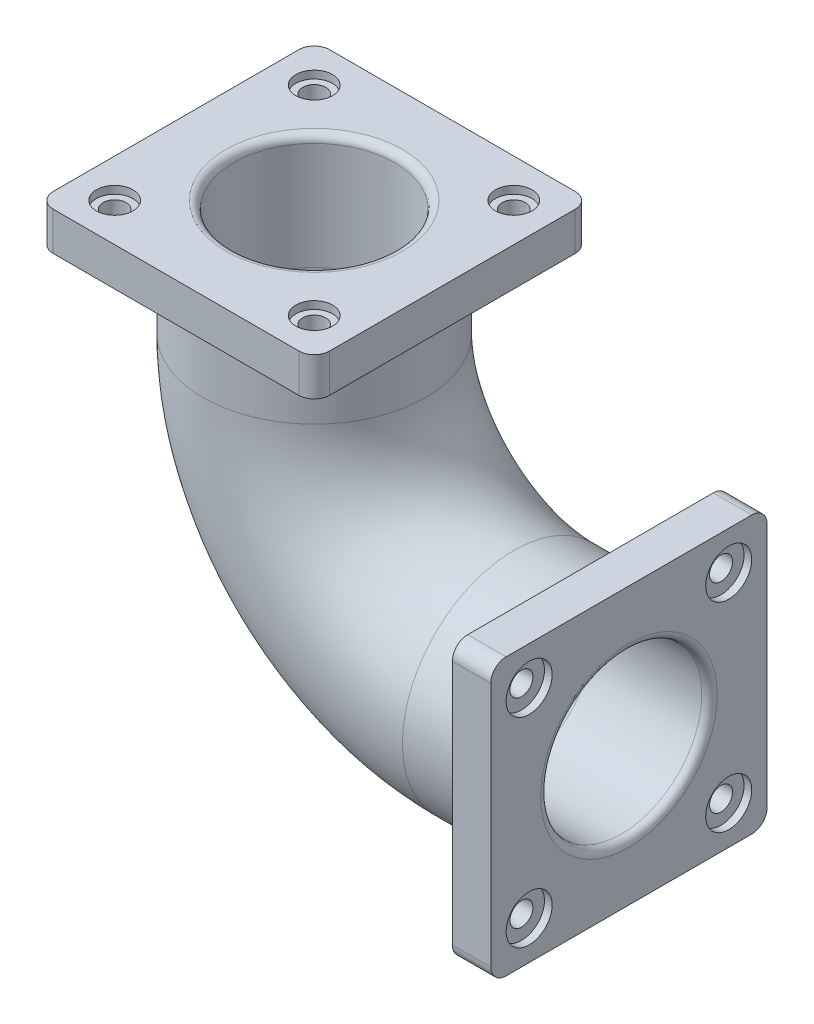
from build123d import *

# Parameters (mm, degrees)
SKETCH1_W           = 360
SKETCH1_H           = 360
SKETCH1_R           = 15
BOSS_EXTRUDE1_DEPTH = 50
FILLET1_R           = 20
SKETCH2_R           = 105
CUT_EXTRUDE1_DEPTH  = 50
SKETCH3_R           = 23.859856378
CUT_EXTRUDE2_DEPTH  = 10
SKETCH5_R           = 145
SKETCH5_R_2         = 105
SKETCH9_W           = 360
SKETCH9_H           = 360
BOSS_EXTRUDE2_DEPTH = 50
FILLET2_R           = 20
SKETCH10_R          = 105
SKETCH10_R_2        = 15
CUT_EXTRUDE3_DEPTH  = 50
SKETCH11_R          = 30
CUT_EXTRUDE4_DEPTH  = 10
FILLET3_R           = 10


with BuildPart() as part:
    # Sketch1 → Boss-Extrude1 (new body)
    with BuildSketch(Plane(origin=(0, 0, 0), x_dir=(1, 0, 0), z_dir=(0, 1, 0))):
        Rectangle(SKETCH1_W, SKETCH1_H)
        with Locations(Location((-130, 130, 0), (0, 0, 270))):
            Circle(SKETCH1_R, mode=Mode.SUBTRACT)
        with Locations(Location((130, 130, 0), (0, 0, 270))):
            Circle(SKETCH1_R, mode=Mode.SUBTRACT)
        with Locations(Location((130, -130, 0), (0, 0, 270))):
            Circle(SKETCH1_R, mode=Mode.SUBTRACT)
        with Locations(Location((-130, -130, 0), (0, 0, 270))):
            Circle(SKETCH1_R, mode=Mode.SUBTRACT)
    extrude(amount=BOSS_EXTRUDE1_DEPTH)

    # Fillet1
    fillet1_edges = [part.edges().sort_by_distance(p)[0] for p in [
        (-180, 25, -180),
        (180, 25, -180),
        (180, 25, 180),
        (-180, 25, 180),
    ]]
    fillet(fillet1_edges, radius=FILLET1_R)

    # Sketch2 → Cut-Extrude1 (cut)
    with BuildSketch(Plane(origin=(0, 50, 0), x_dir=(1, 0, 0), z_dir=(0, 1, 0))):
        with Locations(Location((0, 0, 0), (0, 0, 270))):
            Circle(SKETCH2_R)
    extrude(amount=-CUT_EXTRUDE1_DEPTH, mode=Mode.SUBTRACT)

    # Sketch3 → Cut-Extrude2 (cut)
    with BuildSketch(Plane(origin=(0, 50, 0), x_dir=(1, 0, 0), z_dir=(0, 1, 0))):
        with Locations(Location((-130, 130, 0), (0, 0, 270))):
            Circle(SKETCH3_R)
        with Locations(Location((130, 130, 0), (0, 0, 270))):
            Circle(SKETCH3_R)
        with Locations(Location((130, -130, 0), (0, 0, 270))):
            Circle(SKETCH3_R)
        with Locations(Location((-130, -130, 0), (0, 0, 270))):
            Circle(SKETCH3_R)
    extrude(amount=-CUT_EXTRUDE2_DEPTH, mode=Mode.SUBTRACT)

    # Sweep-Thin1: sweep along a path in Sketch4
    with BuildLine(Plane.XY) as sweep_thin1_path:
        Line((0, 50), (0, -100))
        ThreePointArc((0, -100), (76.152236891, -283.847763109), (260, -360))
        Line((260, -360), (410, -360))
    # Sketch5 → Sweep-Thin1 (sweep)
    with BuildSketch(Plane(origin=(0, 0, 0), x_dir=(1, 0, 0), z_dir=(0, 1, 0))):
        Circle(SKETCH5_R)
        Circle(SKETCH5_R_2, mode=Mode.SUBTRACT)
    sweep(path=sweep_thin1_path.line)

    # Sketch9 → Boss-Extrude2 (add)
    with BuildSketch(Plane(origin=(410, 0, 0), x_dir=(0, 0, -1), z_dir=(1, 0, 0))):
        with Locations((0, -360)):
            Rectangle(SKETCH9_W, SKETCH9_H)
    extrude(amount=-BOSS_EXTRUDE2_DEPTH)

    # Fillet2
    fillet2_edges = [part.edges().sort_by_distance(p)[0] for p in [
        (385, -540, 180),
        (385, -180, 180),
        (385, -180, -180),
        (385, -540, -180),
    ]]
    fillet(fillet2_edges, radius=FILLET2_R)

    # Sketch10 → Cut-Extrude3 (cut)
    with BuildSketch(Plane(origin=(410, 0, 0), x_dir=(0, 0, -1), z_dir=(1, 0, 0))):
        with Locations(Location((0, -360, 0), (0, 0, 90))):
            Circle(SKETCH10_R)
        with Locations(Location((-130, -230, 0), (0, 0, 90))):
            Circle(SKETCH10_R_2)
        with Locations(Location((130, -230, 0), (0, 0, 90))):
            Circle(SKETCH10_R_2)
        with Locations(Location((130, -490, 0), (0, 0, 90))):
            Circle(SKETCH10_R_2)
        with Locations(Location((-130, -490, 0), (0, 0, 90))):
            Circle(SKETCH10_R_2)
    extrude(amount=-CUT_EXTRUDE3_DEPTH, mode=Mode.SUBTRACT)

    # Sketch11 → Cut-Extrude4 (cut)
    with BuildSketch(Plane(origin=(410, 0, 0), x_dir=(0, 0, -1), z_dir=(1, 0, 0))):
        with Locations(Location((-130, -230, 0), (0, 0, 90))):
            Circle(SKETCH11_R)
        with Locations(Location((130, -230, 0), (0, 0, 90))):
            Circle(SKETCH11_R)
        with Locations(Location((130, -490, 0), (0, 0, 90))):
            Circle(SKETCH11_R)
        with Locations(Location((-130, -490, 0), (0, 0, 90))):
            Circle(SKETCH11_R)
    extrude(amount=-CUT_EXTRUDE4_DEPTH, mode=Mode.SUBTRACT)

    # Fillet3
    fillet3_edges = [part.edges().sort_by_distance(p)[0] for p in [
        (410, -465, 0),
        (0, 50, -105),
    ]]
    fillet(fillet3_edges, radius=FILLET3_R)


solid = part.part
